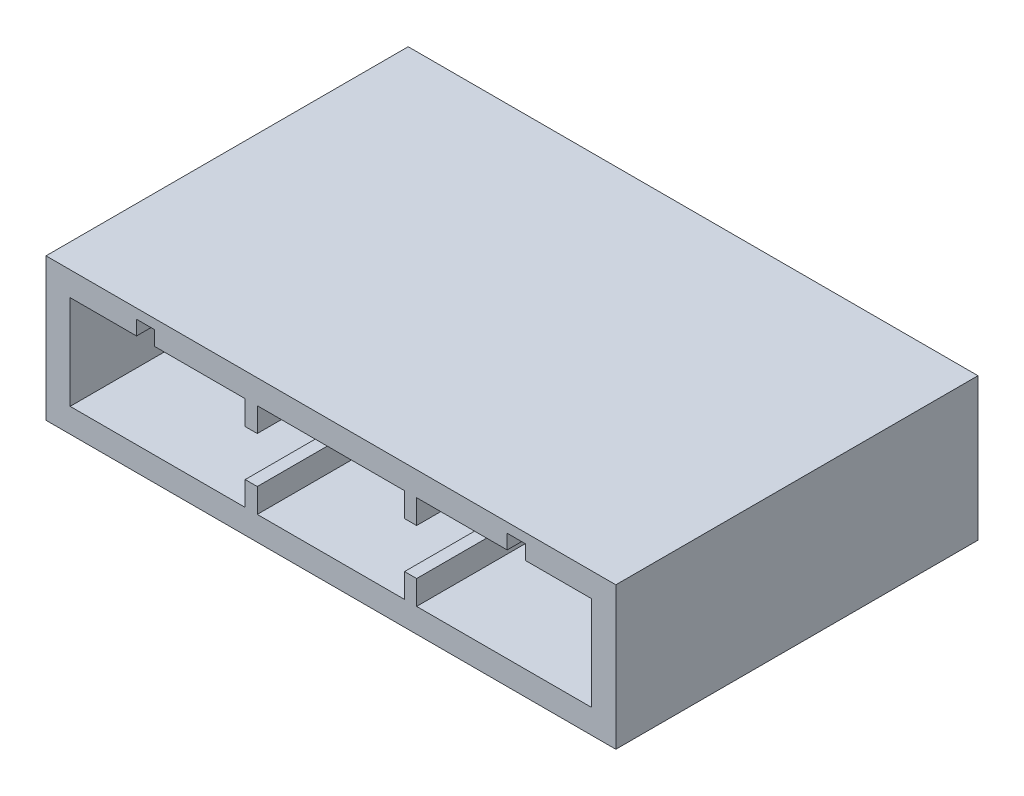
from build123d import *

# Parameters (mm, degrees)
CROQUIS1_W                = 47.2
CROQUIS1_H                = 11.8
CROQUIS1_W_2              = 43.2
CROQUIS1_H_2              = 7.8
SALIENTE_EXTRUIR1_DEPTH   = 20
CROQUIS2_W                = 1.5
CROQUIS2_H                = 1.2
CORTAR_EXTRUIR1_DEPTH     = 20
CROQUIS3_W                = 1
CROQUIS3_H                = 2
SALIENTE_EXTRUIR2_DEPTH   = 20
SALIENTE_EXTRUIR2_2_DEPTH = 20
SALIENTE_EXTRUIR2_3_DEPTH = 20
SALIENTE_EXTRUIR2_4_DEPTH = 20
CROQUIS5_W                = 47.2
CROQUIS5_H                = 11.8
SALIENTE_EXTRUIR3_DEPTH   = 10
CROQUIS6_R                = 0.8
CORTAR_EXTRUIR2_DEPTH     = 10


with BuildPart() as part:
    # Croquis1 → Saliente-Extruir1 (new body)
    with BuildSketch(Plane.XY):
        with Locations((0, -8.96031539)):
            Rectangle(CROQUIS1_W, CROQUIS1_H)
        with Locations((0, -8.96031539)):
            Rectangle(CROQUIS1_W_2, CROQUIS1_H_2, mode=Mode.SUBTRACT)
    extrude(amount=SALIENTE_EXTRUIR1_DEPTH)

    # Croquis2 → Cortar-Extruir1 (cut)
    with BuildSketch(Plane.XY.offset(20)):
        with Locations((-15.35, -4.46031539)):
            Rectangle(CROQUIS2_W, CROQUIS2_H)
        with Locations((15.35, -4.46031539)):
            Rectangle(CROQUIS2_W, CROQUIS2_H)
    extrude(amount=-CORTAR_EXTRUIR1_DEPTH, mode=Mode.SUBTRACT)



with BuildPart() as body_2:
    # Croquis3 → Saliente-Extruir2 (new body)
    with BuildSketch(Plane.XY.offset(20)):
        with Locations((-6.6, -6.06031539)):
            Rectangle(CROQUIS3_W, CROQUIS3_H)
    extrude(amount=-SALIENTE_EXTRUIR2_DEPTH)


with BuildPart() as body_3:
    # Croquis3 → Saliente-Extruir2 2 (new body)
    with BuildSketch(Plane.XY.offset(20)):
        with Locations((6.6, -6.06031539)):
            Rectangle(CROQUIS3_W, CROQUIS3_H)
    extrude(amount=-SALIENTE_EXTRUIR2_2_DEPTH)


with BuildPart() as body_4:
    # Croquis3 → Saliente-Extruir2 3 (new body)
    with BuildSketch(Plane.XY.offset(20)):
        with Locations((-6.6, -11.86031539)):
            Rectangle(CROQUIS3_W, CROQUIS3_H)
    extrude(amount=-SALIENTE_EXTRUIR2_3_DEPTH)


with BuildPart() as body_5:
    # Croquis3 → Saliente-Extruir2 4 (new body)
    with BuildSketch(Plane.XY.offset(20)):
        with Locations((6.6, -11.86031539)):
            Rectangle(CROQUIS3_W, CROQUIS3_H)
    extrude(amount=-SALIENTE_EXTRUIR2_4_DEPTH)


with BuildPart() as part_1:
    add(part.part)

    add(body_2.part)  # Saliente-Extruir3 merges body 2

    add(body_3.part)  # Saliente-Extruir3 merges body 3

    add(body_4.part)  # Saliente-Extruir3 merges body 4

    add(body_5.part)  # Saliente-Extruir3 merges body 5
    # Croquis5 → Saliente-Extruir3 (add)
    with BuildSketch(Plane(origin=(0, 0, 0), x_dir=(-1, 0, 0), z_dir=(0, 0, -1))):
        with Locations((0, -8.96031539)):
            Rectangle(CROQUIS5_W, CROQUIS5_H)
    extrude(amount=SALIENTE_EXTRUIR3_DEPTH)

    # Croquis6 → Cortar-Extruir2 (cut)
    with BuildSketch(Plane.XY):
        with Locations((-4.685466197, -10.055288468)):
            Circle(CROQUIS6_R)
        with Locations((2.49552004, -8.782063958)):
            Circle(CROQUIS6_R)
    extrude(amount=-CORTAR_EXTRUIR2_DEPTH, mode=Mode.SUBTRACT)


solid = part_1.part
